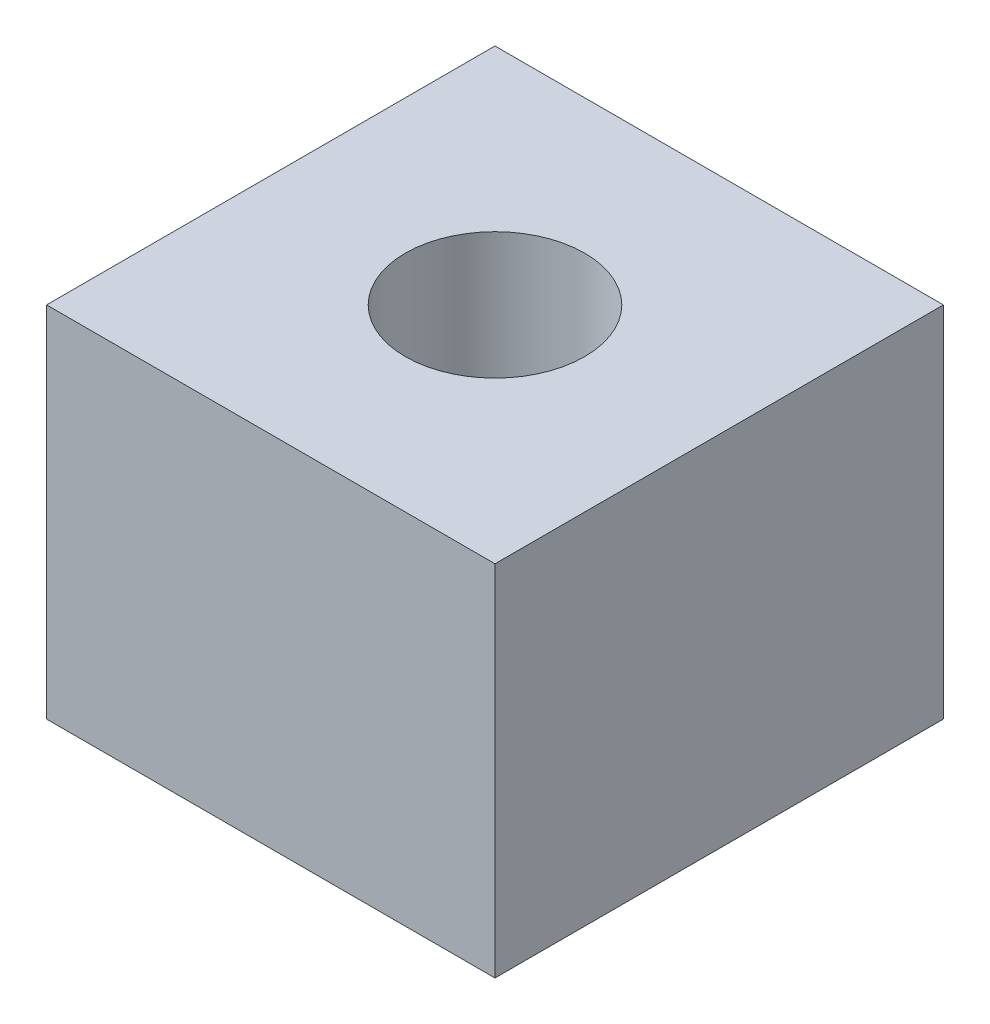
from build123d import *

# Parameters (mm, degrees)
SKETCH1_W               = 2.5
SKETCH1_H               = 2.5
BOSS_EXTRUDE1_DEPTH     = 2
CUT_EXTRUDE1_DEPTH      = 3.669269563
CUT_EXTRUDE1_DEPTH_BACK = 3.669269563
SKETCH2_R               = 0.5
SCALE1_SCALE            = 6


with BuildPart() as part:
    # Sketch1 → Boss-Extrude1 (new body)
    with BuildSketch(Plane(origin=(0, 0, 0), x_dir=(1, 0, 0), z_dir=(0, 1, 0))):
        Rectangle(SKETCH1_W, SKETCH1_H)
    extrude(amount=BOSS_EXTRUDE1_DEPTH)

    # Sketch2 → Cut-Extrude1 (cut, two sides: drawn at the far end of the back side and taken through both)
    with BuildSketch(Plane(origin=(0, 2, 0), x_dir=(1, 0, 0), z_dir=(0, 1, 0)).offset(-CUT_EXTRUDE1_DEPTH_BACK)):
        with Locations(Location((0, 0, 0), (0, 0, 270))):
            Circle(SKETCH2_R)
    extrude(amount=CUT_EXTRUDE1_DEPTH + CUT_EXTRUDE1_DEPTH_BACK, mode=Mode.SUBTRACT)


with BuildPart() as part_1:
    # Scale1: scaled about (0, 1, 0)
    add(part.part.scale(SCALE1_SCALE).moved(Location((0, -5, 0))))


solid = part_1.part
